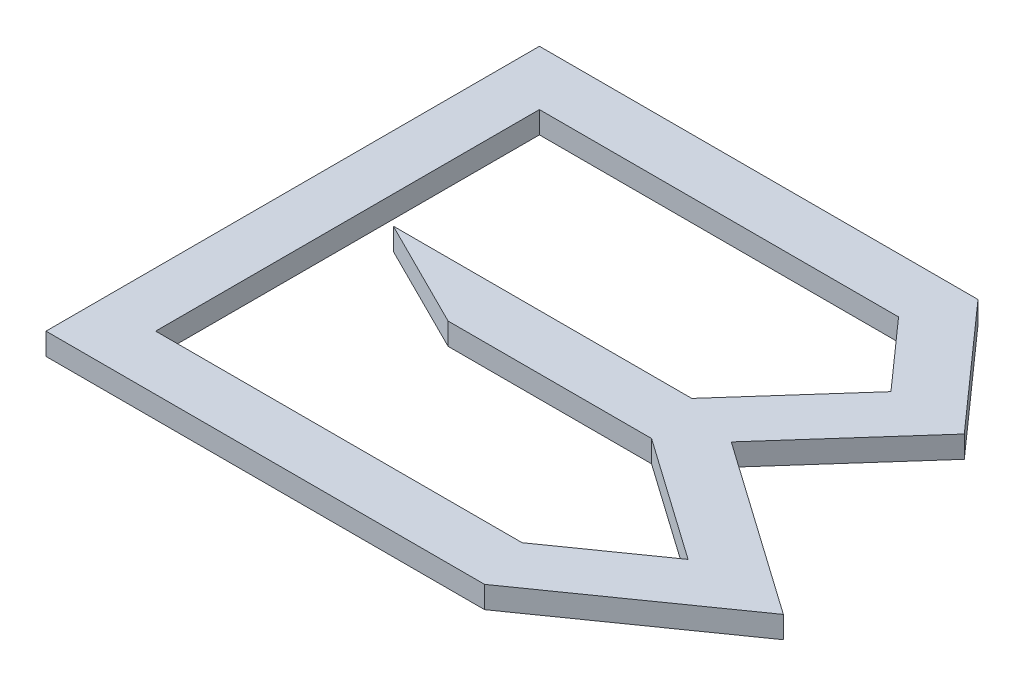
from build123d import *

# Parameters (mm, degrees)
BOSS_EXTRUDE1_DEPTH = 2


with BuildPart() as part:
    # Sketch2 → Boss-Extrude1 (new body)
    with BuildSketch(Plane(origin=(0, 0, 0), x_dir=(1, 0, 0), z_dir=(0, 1, 0))):
        Polygon((17.5, 22.5), (22.5, 22.5), (32.5, 11.25), (22.5, 0), (38.5, -11.25), (22.5, -22.5), (17.5, -22.5), (-17.5, -22.5), (-17.5, 22.5), align=None)
        Polygon((17.5, 17.5), (20.254669678, 17.5), (25.810225234, 11.25), (17.261983906, 1.633228506), (15.039761683, 1.633228506), (-9.960238317, 1.633228506), (0.039761683, -3.366771494), (15.039761683, -3.366771494), (18.595317239, -3.366771494), (29.807020003, -11.25), (20.918131114, -17.5), (17.5, -17.5), (-12.5, -17.5), (-12.5, 17.5), align=None, mode=Mode.SUBTRACT)
    extrude(amount=BOSS_EXTRUDE1_DEPTH)


solid = part.part
